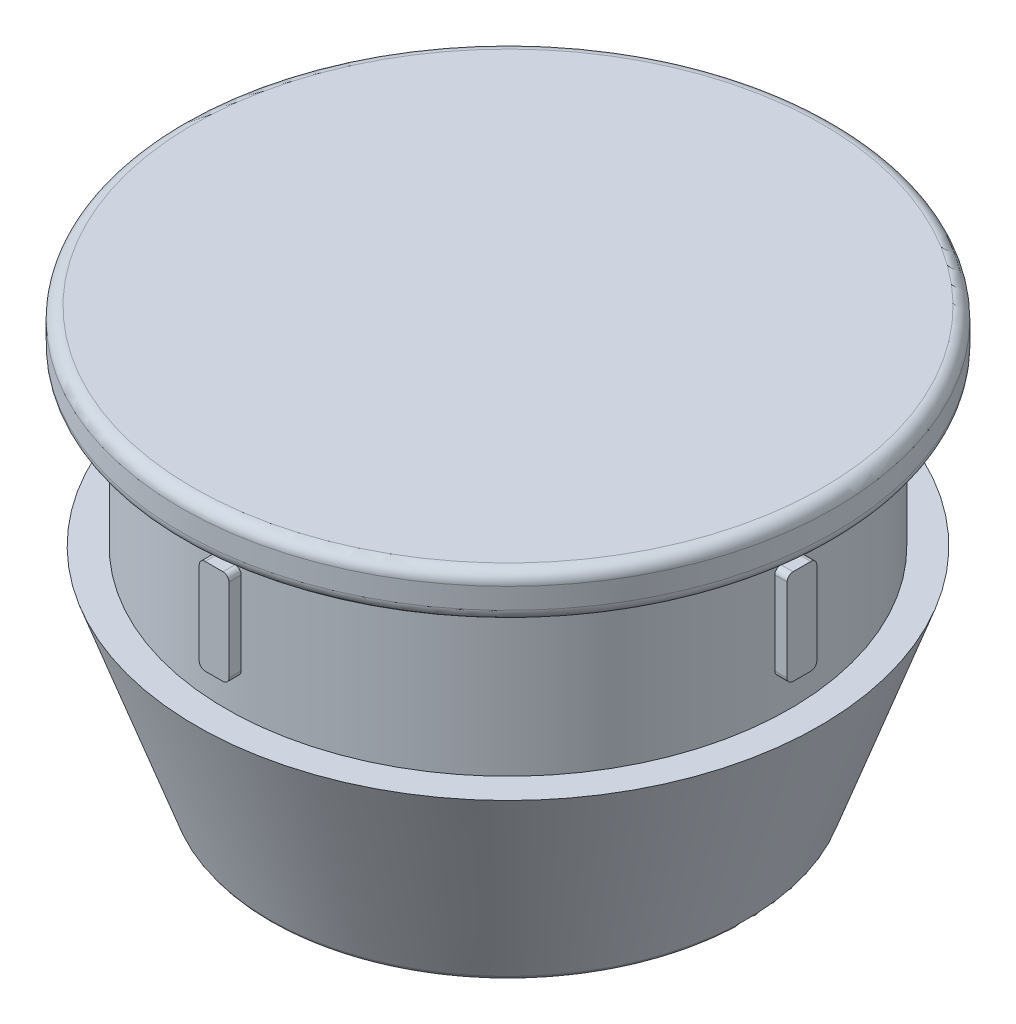
from build123d import *

# Parameters (mm, degrees)
SKETCH2_W                = 1.27
SKETCH2_H                = 4.064
BOSS_EXTRUDE1_DEPTH      = 3.048
FILLET1_R                = 0.508
FILLET2_R                = 0.254
CIRPATTERN1_COUNT        = 4
FILLET2_OF_CIRPATTERN1_R = 0.254


with BuildPart() as part:
    # Sketch1 → Revolve1 (revolve)
    with BuildSketch(Plane.XY, mode=Mode.PRIVATE) as revolve1_sk:
        Polygon((13.335, -6.985), (10.16, -15.875), (9.525, -15.875), (9.525, 0), (0, 0), (0, 1.905), (13.97, 1.905), (13.97, 0), (12.065, 0), (12.065, -6.985), align=None)
    revolve(revolve1_sk.sketch.rotate(Axis((0, 0, 0), (0, 1, 0)), 90), axis=Axis((0, 0, 0), (0, 1, 0)))

    # Sketch2 → Boss-Extrude1 (add)
    with BuildSketch(Plane.ZY.offset(-9.525)):
        with Locations((0, -3.4925)):
            Rectangle(SKETCH2_W, SKETCH2_H)
    boss_extrude1 = extrude(amount=-BOSS_EXTRUDE1_DEPTH)

    # Fillet1
    fillet1_edges = [part.edges().sort_by_distance(p)[0] for p in [
        (0, 0, 12.065),
        (0, 0, 9.525),
        (0, 1.905, 13.97),
        (0, 0, 13.97),
    ]]
    fillet(fillet1_edges, radius=FILLET1_R)

    # Fillet2
    fillet2_edges = [part.edges().sort_by_distance(p)[0] for p in [
        (0, -15.875, 10.16),
        (0, -15.875, 9.525),
        (12.310638943, -5.5245, -0.635),
        (12.310638943, -1.4605, -0.635),
        (12.310638943, -1.4605, 0.635),
        (12.310638943, -5.5245, 0.635),
    ]]
    fillet(fillet2_edges, radius=FILLET2_R)

    # CirPattern1: Boss-Extrude1 ×4 about axis
    cirpattern1_axis = Axis((0, 0, 0), (0, 1, 0))
    for i in range(1, CIRPATTERN1_COUNT):
        add(boss_extrude1.rotate(cirpattern1_axis, i * 360 / CIRPATTERN1_COUNT))

    # Fillet2 of CirPattern1
    fillet2_of_cirpattern1_edges = [part.edges().sort_by_distance(p)[0] for p in [
        (10.16, -15.875, 0),
        (9.525, -15.875, 0),
        (-0.635, -5.5245, -12.310638943),
        (-0.635, -1.4605, -12.310638943),
        (0.635, -1.4605, -12.310638943),
        (0.635, -5.5245, -12.310638943),
        (0, -15.875, -10.16),
        (0, -15.875, -9.525),
        (-12.310638943, -5.5245, 0.635),
        (-12.310638943, -1.4605, 0.635),
        (-12.310638943, -1.4605, -0.635),
        (-12.310638943, -5.5245, -0.635),
        (-10.16, -15.875, 0),
        (-9.525, -15.875, 0),
        (0.635, -5.5245, 12.310638943),
        (0.635, -1.4605, 12.310638943),
        (-0.635, -1.4605, 12.310638943),
        (-0.635, -5.5245, 12.310638943),
    ]]
    fillet(fillet2_of_cirpattern1_edges, radius=FILLET2_OF_CIRPATTERN1_R)


solid = part.part
